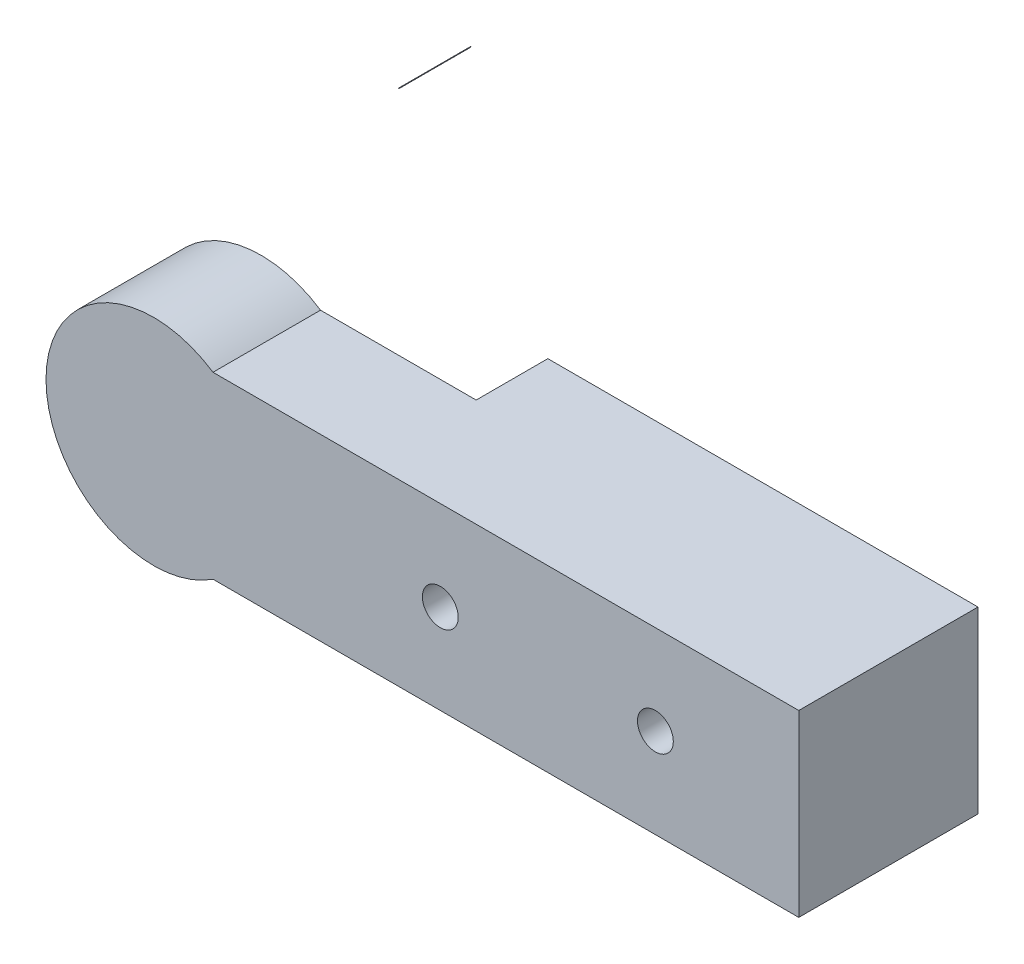
from build123d import *
from build123d.topology import SkipClean

# Parameters (mm, degrees)
SKETCH2_R           = 2.5
BOSS_EXTRUDE1_DEPTH = 15
BOSS_EXTRUDE2_START = 10
SKETCH3_R           = 0.035747797
SKETCH3_W           = 60
SKETCH3_H           = 25
SKETCH3_R_2         = 2.5
BOSS_EXTRUDE2_DEPTH = 10


with BuildPart() as part:
    # Sketch2 → Boss-Extrude1 (new body)
    # profile 1 of 5: a face of its own
    with BuildSketch(Plane.XY):
        with BuildLine():
            Line((0, -12.5), (0, 12.5))
            Line((0, 12.5), (8.291561976, 12.5))
            ThreePointArc((8.291561976, 12.5), (-15, 0), (8.291561976, -12.5))
            Line((8.291561976, -12.5), (0, -12.5))
        make_face()
    # profile 2 of 5: a face of its own
    with BuildSketch(Plane.XY):
        with BuildLine():
            Line((8.291561976, 12.5), (0, 12.5))
            Line((0, 12.5), (0, -12.5))
            Line((0, -12.5), (8.291561976, -12.5))
            ThreePointArc((8.291561976, -12.5), (13.216910184, -7.093185827), (15, 0))
            ThreePointArc((15, 0), (13.216910184, 7.093185827), (8.291561976, 12.5))
        make_face()
    # profile 3 of 5: a face of its own
    with BuildSketch(Plane.XY):
        with BuildLine():
            Line((0, -12.5), (0, 12.5))
            Line((0, 12.5), (8.291561976, 12.5))
            ThreePointArc((8.291561976, 12.5), (-15, 0), (8.291561976, -12.5))
            Line((8.291561976, -12.5), (0, -12.5))
        make_face()
    # profile 4 of 5: a face of its own
    with BuildSketch(Plane.XY):
        with BuildLine():
            Line((8.291561976, 12.5), (0, 12.5))
            Line((0, 12.5), (0, -12.5))
            Line((0, -12.5), (8.291561976, -12.5))
            ThreePointArc((8.291561976, -12.5), (13.216910184, -7.093185827), (15, 0))
            ThreePointArc((15, 0), (13.216910184, 7.093185827), (8.291561976, 12.5))
        make_face()
    # profile 5 of 5: a face of its own
    with BuildSketch(Plane.XY):
        with BuildLine():
            Line((90, 12.5), (8.291561976, 12.5))
            ThreePointArc((8.291561976, 12.5), (13.216910184, 7.093185827), (15, 0))
            ThreePointArc((15, 0), (13.216910184, -7.093185827), (8.291561976, -12.5))
            Line((8.291561976, -12.5), (90, -12.5))
            Line((90, -12.5), (90, 12.5))
        make_face()
        with Locations((40, 0)):
            Circle(SKETCH2_R, mode=Mode.SUBTRACT)
        with Locations((70, 0)):
            Circle(SKETCH2_R, mode=Mode.SUBTRACT)
    extrude(amount=BOSS_EXTRUDE1_DEPTH)

    # Sketch3 → Boss-Extrude2 (add)
    # profile 1 of 2: a face of its own
    with SkipClean():  # the faces are left unmerged after this step: merging them gives an invalid solid
        with BuildSketch(Plane(origin=(0, 0, 0), x_dir=(-1, 0, 0), z_dir=(0, 0, -1)).offset(BOSS_EXTRUDE2_START)):
            with Locations((-19.225929264, 44.771435035)):
                Circle(SKETCH3_R)
        # profile 2 of 2: a face of its own
        with BuildSketch(Plane(origin=(0, 0, 0), x_dir=(-1, 0, 0), z_dir=(0, 0, -1)).offset(BOSS_EXTRUDE2_START)):
            with Locations((-60, 0)):
                Rectangle(SKETCH3_W, SKETCH3_H)
            with Locations((-40, 0)):
                Circle(SKETCH3_R_2, mode=Mode.SUBTRACT)
            with Locations((-70, 0)):
                Circle(SKETCH3_R_2, mode=Mode.SUBTRACT)
        extrude(amount=-BOSS_EXTRUDE2_DEPTH)


with BuildPart() as boss_extrude2_piece_1:
    # of the separate pieces the step leaves, piece 1, a body of its own (boss_extrude2_pieces)
    add(part.part.solids().sort_by_distance((8.291561976, -12.5, 0))[0])


with BuildPart() as boss_extrude2_piece_2:
    # of the separate pieces the step leaves, piece 2, a body of its own (boss_extrude2_pieces)
    add(part.part.solids().sort_by_distance((19.190181466, 44.771435035, -10))[0])


solid = Compound([boss_extrude2_piece_1.part, boss_extrude2_piece_2.part])
